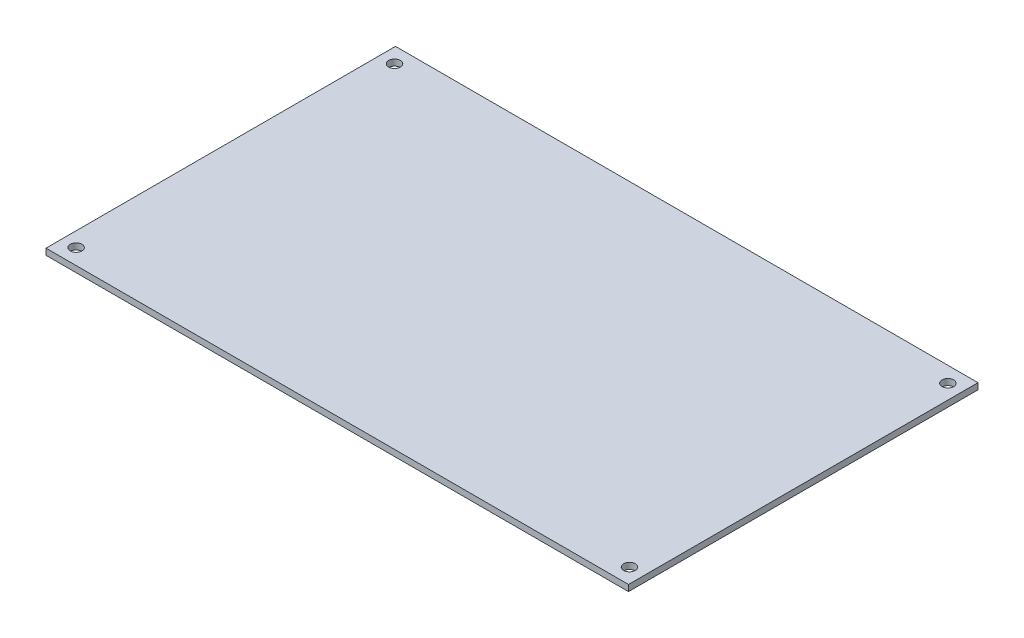
from build123d import *

# Parameters (mm, degrees)
SKETCH1_W           = 150
SKETCH1_H           = 90
BOSS_EXTRUDE1_DEPTH = 1.6
SKETCH2_R           = 1.5
CUT_EXTRUDE1_DEPTH  = 1.6


with BuildPart() as part:
    # Sketch1 → Boss-Extrude1 (new body)
    with BuildSketch(Plane(origin=(0, 0, 0), x_dir=(1, 0, 0), z_dir=(0, 1, 0))):
        Rectangle(SKETCH1_W, SKETCH1_H)
    extrude(amount=BOSS_EXTRUDE1_DEPTH)

    # Sketch2 → Cut-Extrude1 (cut)
    with BuildSketch(Plane(origin=(0, 1.6, 0), x_dir=(1, 0, 0), z_dir=(0, 1, 0))):
        with Locations(Location((-71.25, 41, 0), (0, 0, 270))):
            Circle(SKETCH2_R)
        with Locations(Location((-71.25, -41, 0), (0, 0, 270))):
            Circle(SKETCH2_R)
        with Locations(Location((71.25, -41, 0), (0, 0, 270))):
            Circle(SKETCH2_R)
        with Locations(Location((71.25, 41, 0), (0, 0, 270))):
            Circle(SKETCH2_R)
    extrude(amount=-CUT_EXTRUDE1_DEPTH, mode=Mode.SUBTRACT)


solid = part.part
